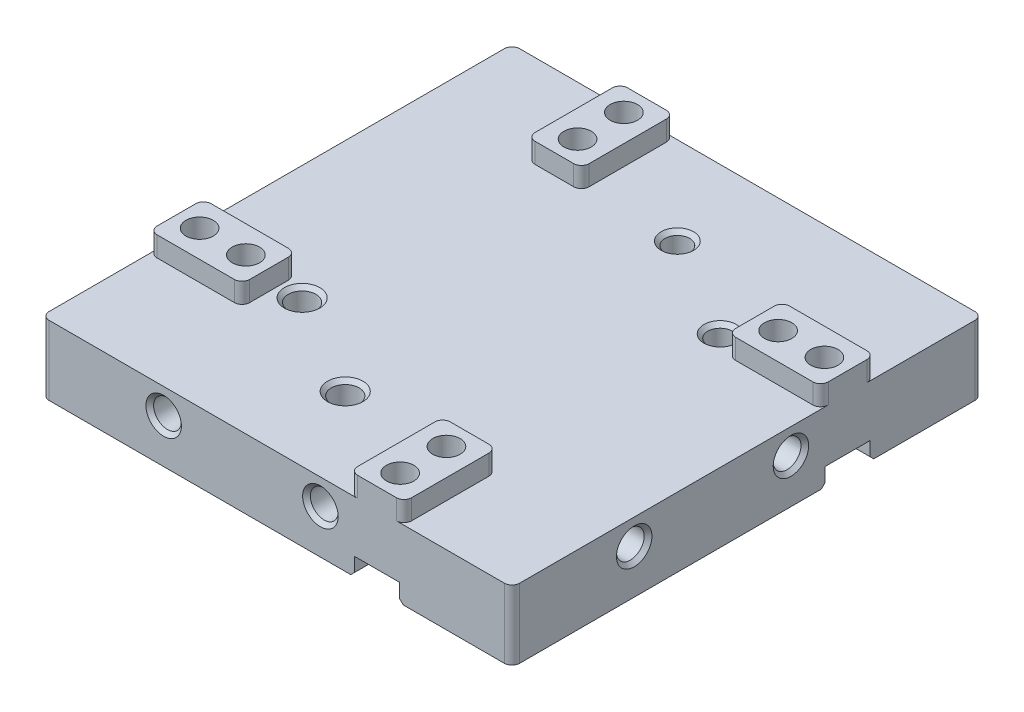
from build123d import *

# Parameters (mm, degrees)
SKETCH1_W           = 61
SKETCH1_H           = 61
BOSS_EXTRUDE2_DEPTH = 9
SKETCH6_W           = 7
SKETCH6_H           = 12
SKETCH6_W_2         = 12
SKETCH6_H_2         = 7
BOSS_EXTRUDE4_DEPTH = 2.6
CIRPATTERN3_COUNT   = 4
SKETCH8_R           = 1.775
CUT_EXTRUDE3_DEPTH  = 45.666094524
CIRPATTERN4_COUNT   = 4
SKETCH10_W          = 11.9
SKETCH10_H          = 5.8
SKETCH10_W_2        = 5.8
SKETCH10_H_2        = 11.9
CUT_EXTRUDE6_DEPTH  = 2.3
SKETCH12_R          = 2.05
CUT_EXTRUDE8_DEPTH  = 6.5
FILLET1_R           = 1
SKETCH14_R          = 1.8
CUT_EXTRUDE10_DEPTH = 6.5
CIRPATTERN5_COUNT   = 4
CHAMFER1_SIZE       = 0.5
SKETCH16_R          = 1.8
CUT_EXTRUDE11_DEPTH = 6.5
SKETCH18_R          = 1.6
CUT_EXTRUDE12_DEPTH = 4.5
CHAMFER2_SIZE       = 0.5


with BuildPart() as part:
    # Sketch1 → Boss-Extrude2 (new body)
    with BuildSketch(Plane(origin=(0, 0, 0), x_dir=(1, 0, 0), z_dir=(0, 1, 0))):
        Rectangle(SKETCH1_W, SKETCH1_H)
    extrude(amount=BOSS_EXTRUDE2_DEPTH)

    # Sketch6 → Boss-Extrude4 (add)
    with BuildSketch(Plane(origin=(0, 9, 0), x_dir=(1, 0, 0), z_dir=(0, 1, 0))):
        with Locations((13, -24.5)):
            Rectangle(SKETCH6_W, SKETCH6_H)
        with Locations((24.5, 13)):
            Rectangle(SKETCH6_W_2, SKETCH6_H_2)
    boss_extrude4 = extrude(amount=BOSS_EXTRUDE4_DEPTH)

    # CirPattern3: Boss-Extrude4 ×4 about axis
    cirpattern3_axis = Axis((0, 0, 0), (0, 1, 0))
    for i in range(1, CIRPATTERN3_COUNT):
        add(boss_extrude4.rotate(cirpattern3_axis, i * 360 / CIRPATTERN3_COUNT))

    # Sketch8 → Cut-Extrude3 (cut, through all)
    with BuildSketch(Plane(origin=(0, 11.6, 0), x_dir=(1, 0, 0), z_dir=(0, 1, 0))):
        with Locations(Location((13, -21.5, 0), (0, 0, 270))):
            Circle(SKETCH8_R)
        with Locations(Location((13, -27.5, 0), (0, 0, 270))):
            Circle(SKETCH8_R)
    cut_extrude3 = extrude(amount=-CUT_EXTRUDE3_DEPTH, mode=Mode.SUBTRACT)

    # CirPattern4: Cut-Extrude3 ×4 about axis
    cirpattern4_axis = Axis((0, 0, 0), (0, 1, 0))
    for i in range(1, CIRPATTERN4_COUNT):
        add(cut_extrude3.rotate(cirpattern4_axis, i * 360 / CIRPATTERN4_COUNT), mode=Mode.SUBTRACT)

    # Sketch10 → Cut-Extrude6 (cut)
    with BuildSketch(Plane.XZ):
        with Locations((-24.55, 13)):
            Rectangle(SKETCH10_W, SKETCH10_H)
        with Locations((13, 24.55)):
            Rectangle(SKETCH10_W_2, SKETCH10_H_2)
        with Locations((24.55, -13)):
            Rectangle(SKETCH10_W, SKETCH10_H)
        with Locations((-13, -24.55)):
            Rectangle(SKETCH10_W_2, SKETCH10_H_2)
    extrude(amount=-CUT_EXTRUDE6_DEPTH, mode=Mode.SUBTRACT)

    # Sketch12 → Cut-Extrude8 (cut)
    with BuildSketch(Plane.XZ):
        with Locations(Location((-26, 26, 0), (0, 0, 270))):
            Circle(SKETCH12_R)
        with Locations(Location((26, 26, 0), (0, 0, 270))):
            Circle(SKETCH12_R)
        with Locations(Location((-26, -26, 0), (0, 0, 270))):
            Circle(SKETCH12_R)
        with Locations(Location((26, -26, 0), (0, 0, 270))):
            Circle(SKETCH12_R)
    extrude(amount=-CUT_EXTRUDE8_DEPTH, mode=Mode.SUBTRACT)

    # Fillet1
    fillet1_edges = [part.edges().sort_by_distance(p)[0] for p in [
        (30.5, 10.3, -9.5),
        (30.5, 10.3, -16.5),
        (18.5, 10.3, -16.5),
        (18.5, 10.3, -9.5),
        (9.5, 10.3, 18.5),
        (9.5, 10.3, 30.5),
        (16.5, 10.3, 30.5),
        (16.5, 10.3, 18.5),
        (-18.5, 10.3, 9.5),
        (-30.5, 10.3, 9.5),
        (-30.5, 10.3, 16.5),
        (-18.5, 10.3, 16.5),
        (-9.5, 10.3, -18.5),
        (-9.5, 10.3, -30.5),
        (-16.5, 10.3, -30.5),
        (-16.5, 10.3, -18.5),
        (-30.5, 4.5, -30.5),
        (30.5, 4.5, -30.5),
        (30.5, 4.5, 30.5),
        (-30.5, 4.5, 30.5),
    ]]
    fillet(fillet1_edges, radius=FILLET1_R)

    # Sketch14 → Cut-Extrude10 (cut)
    with BuildSketch(Plane.XY.offset(30.5)):
        with Locations((-14.66, 5.71)):
            Circle(SKETCH14_R)
        with Locations((5.66, 5.71)):
            Circle(SKETCH14_R)
    cut_extrude10 = extrude(amount=-CUT_EXTRUDE10_DEPTH, mode=Mode.SUBTRACT)

    # CirPattern5: Cut-Extrude10 ×4 about axis
    cirpattern5_axis = Axis((0, 0, 0), (0, 1, 0))
    for i in range(1, CIRPATTERN5_COUNT):
        add(cut_extrude10.rotate(cirpattern5_axis, i * 360 / CIRPATTERN5_COUNT), mode=Mode.SUBTRACT)

    # Chamfer1
    chamfer1_edges = [part.edges().sort_by_distance(p)[0] for p in [
        (-24.55, 0, 10.1),
        (-18.6, 0, 13),
        (-24.55, 0, 15.9),
        (10.1, 0, 24.55),
        (13, 0, 18.6),
        (15.9, 0, 24.55),
        (24.55, 0, -10.1),
        (18.6, 0, -13),
        (24.55, 0, -15.9),
        (-10.1, 0, -24.55),
        (-13, 0, -18.6),
        (-15.9, 0, -24.55),
        (-26, 0, 28.05),
        (-26, 0, -23.95),
        (26, 0, -23.95),
        (26, 0, 28.05),
        (-16.46, 5.71, 30.5),
        (3.86, 5.71, 30.5),
        (30.5, 5.71, 16.46),
        (30.5, 5.71, -3.86),
        (16.46, 5.71, -30.5),
        (-3.86, 5.71, -30.5),
        (-30.5, 5.71, -16.46),
        (-30.5, 5.71, 3.86),
    ]]
    chamfer(chamfer1_edges, length=CHAMFER1_SIZE)

    # Sketch16 → Cut-Extrude11 (cut)
    with BuildSketch(Plane(origin=(0, 9, 0), x_dir=(1, 0, 0), z_dir=(0, 1, 0))):
        with Locations(Location((-15.632217848, -11.576300085, 0), (0, 0, 270))):
            Circle(SKETCH16_R)
        with Locations(Location((-2.335254394, -19.285234053, 0), (0, 0, 270))):
            Circle(SKETCH16_R)
    extrude(amount=-CUT_EXTRUDE11_DEPTH, mode=Mode.SUBTRACT)

    # Sketch18 → Cut-Extrude12 (cut)
    with BuildSketch(Plane(origin=(0, 9, 0), x_dir=(1, 0, 0), z_dir=(0, 1, 0))):
        with Locations(Location((15.5, 11.478387332, 0), (0, 0, 270))):
            Circle(SKETCH18_R)
        with Locations(Location((2.315502731, 19.122118865, 0), (0, 0, 270))):
            Circle(SKETCH18_R)
    extrude(amount=-CUT_EXTRUDE12_DEPTH, mode=Mode.SUBTRACT)

    # Chamfer2
    chamfer2_edges = [part.edges().sort_by_distance(p)[0] for p in [
        (-15.632217848, 9, 9.776300085),
        (-2.335254394, 9, 17.485234053),
        (15.5, 9, -13.078387332),
        (2.315502731, 9, -20.722118865),
    ]]
    chamfer(chamfer2_edges, length=CHAMFER2_SIZE)


solid = part.part
